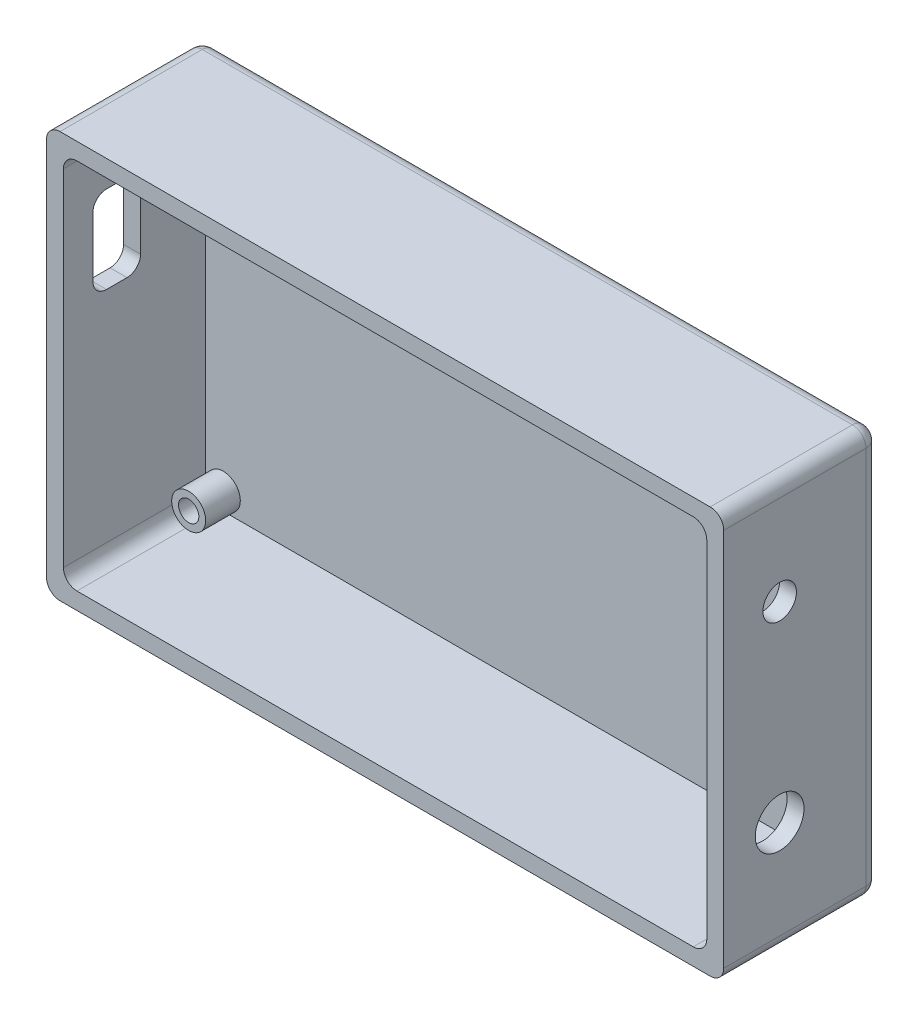
from build123d import *

# Parameters (mm, degrees)
SKETCH1_W                 = 100
SKETCH1_H                 = 60
BOSS_EXTRUDE1_DEPTH       = 23
SKETCH2_W                 = 95
SKETCH2_H                 = 55
CUT_EXTRUDE1_DEPTH        = 21
SKETCH3_R                 = 2.51
SKETCH3_R_2               = 1.5
BOSS_EXTRUDE6_DEPTH       = 5.112
MIRROR2_COPY_1_SKETCH_R   = 2.51
MIRROR2_COPY_1_SKETCH_R_2 = 1.5
MIRROR2_COPY_1_DEPTH      = 5.112
FILLET1_R                 = 2
CUT_EXTRUDE2_REACH        = 108.907
SKETCH4_W                 = 7.027664142
SKETCH4_H                 = 12.843863723
FILLET2_R                 = 2
CUT_EXTRUDE3_REACH        = 108.907
SKETCH5_R                 = 3.6
SKETCH5_R_2               = 2.475


with BuildPart() as part:
    # Sketch1 → Boss-Extrude1 (new body)
    with BuildSketch(Plane.XY):
        Rectangle(SKETCH1_W, SKETCH1_H)
    extrude(amount=BOSS_EXTRUDE1_DEPTH)

    # Sketch2 → Cut-Extrude1 (cut)
    with BuildSketch(Plane.XY.offset(23)):
        Rectangle(SKETCH2_W, SKETCH2_H)
    extrude(amount=-CUT_EXTRUDE1_DEPTH, mode=Mode.SUBTRACT)

    # Sketch3 → Boss-Extrude6 (add)
    with BuildSketch(Plane.XY.offset(2)):
        with Locations((-44.89, 24.89)):
            Circle(SKETCH3_R)
        with Locations((-44.89, 24.89)):
            Circle(SKETCH3_R_2, mode=Mode.SUBTRACT)
    boss_extrude6 = extrude(amount=BOSS_EXTRUDE6_DEPTH)

    # Mirror1: Boss-Extrude6 across plane
    add(boss_extrude6.mirror(Plane.ZX))

    # Mirror2: Boss-Extrude6 across plane
    add(boss_extrude6.mirror(Plane(origin=(0, 0, 0), x_dir=(0, 0, 1), z_dir=(1, 0, 0))))

    # Mirror2 copy 1 sketch → Mirror2 copy 1 (add)
    with BuildSketch(Plane(origin=(0, 0, 2), x_dir=(-1, 0, 0), z_dir=(0, 0, 1))):
        with Locations((-44.89, 24.89)):
            Circle(MIRROR2_COPY_1_SKETCH_R)
        with Locations((-44.89, 24.89)):
            Circle(MIRROR2_COPY_1_SKETCH_R_2, mode=Mode.SUBTRACT)
    extrude(amount=MIRROR2_COPY_1_DEPTH)

    # Fillet1
    fillet1_edges = [part.edges().sort_by_distance(p)[0] for p in [
        (-47.5, 27.5, 12.5),
        (47.5, 27.5, 12.5),
        (47.5, -27.5, 12.5),
        (-47.5, -27.5, 12.5),
        (0, -30, 0),
        (-50, 0, 0),
        (0, 30, 0),
        (50, 0, 0),
        (50, -30, 11.5),
        (-50, -30, 11.5),
        (-50, 30, 11.5),
        (50, 30, 11.5),
    ]]
    fillet(fillet1_edges, radius=FILLET1_R)

    # Sketch4 → Cut-Extrude2 (cut, up to next)
    with BuildSketch(Plane.ZY.offset(50), mode=Mode.PRIVATE) as cut_extrude2_sk1:
        with Locations((15.125832071, 13.30134155)):
            Rectangle(SKETCH4_W, SKETCH4_H)
    cut_extrude2_tool1 = extrude(cut_extrude2_sk1.sketch, amount=-CUT_EXTRUDE2_REACH, mode=Mode.PRIVATE) & part.part
    add(cut_extrude2_tool1.solids().sort_by_distance((-50, 13.301342, 15.125832))[0], mode=Mode.SUBTRACT)

    # Fillet2
    fillet2_edges = [part.edges().sort_by_distance(p)[0] for p in [
        (-48.75, 19.723273411, 11.612),
        (-48.75, 6.879409688, 11.612),
        (-48.75, 6.879409688, 18.639664142),
        (-48.75, 19.723273411, 18.639664142),
    ]]
    fillet(fillet2_edges, radius=FILLET2_R)

    # Sketch5 → Cut-Extrude3 (cut, up to next)
    with BuildSketch(Plane(origin=(50, 0, 0), x_dir=(0, 0, -1), z_dir=(1, 0, 0)), mode=Mode.PRIVATE) as cut_extrude3_sk1:
        with Locations((-14.745, -13.49)):
            Circle(SKETCH5_R)
    cut_extrude3_tool1 = extrude(cut_extrude3_sk1.sketch, amount=-CUT_EXTRUDE3_REACH, mode=Mode.PRIVATE) & part.part
    # Sketch5 → Cut-Extrude3 (cut, up to next)
    with BuildSketch(Plane(origin=(50, 0, 0), x_dir=(0, 0, -1), z_dir=(1, 0, 0)), mode=Mode.PRIVATE) as cut_extrude3_sk2:
        with Locations((-14.74, 14.76)):
            Circle(SKETCH5_R_2)
    cut_extrude3_tool2 = extrude(cut_extrude3_sk2.sketch, amount=-CUT_EXTRUDE3_REACH, mode=Mode.PRIVATE) & part.part
    add(cut_extrude3_tool1.solids().sort_by_distance((50, -13.49, 14.745))[0], mode=Mode.SUBTRACT)
    add(cut_extrude3_tool2.solids().sort_by_distance((50, 14.76, 14.74))[0], mode=Mode.SUBTRACT)


solid = part.part
